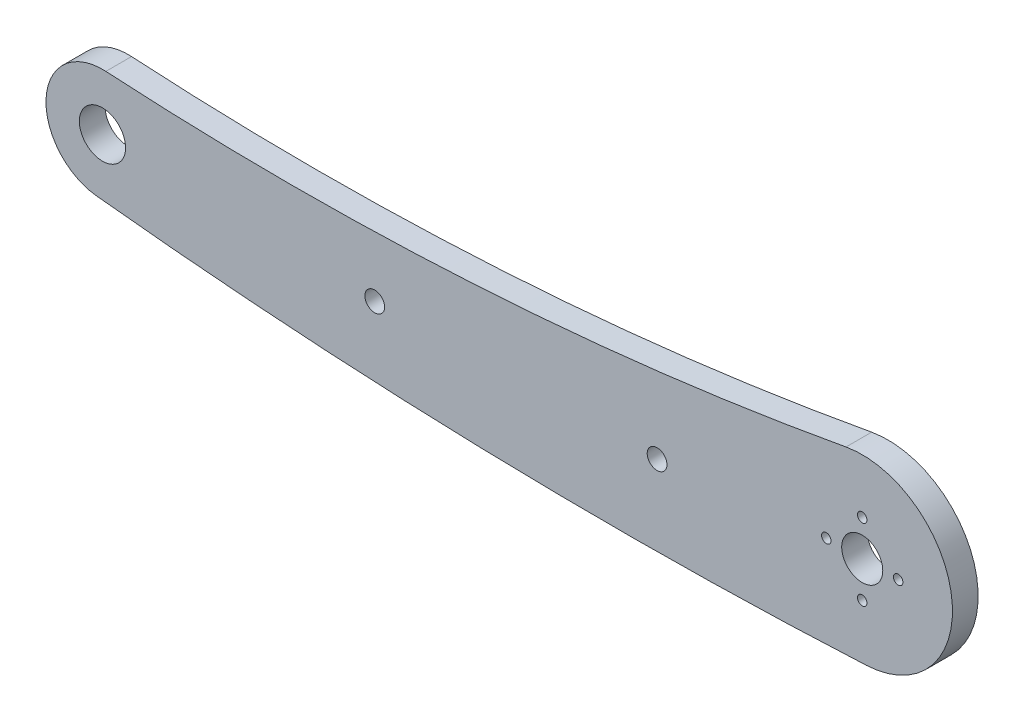
from build123d import *

# Parameters (mm, degrees)
ESQUISSE1_R        = 1.925
ESQUISSE1_R_2      = 0.925
ESQUISSE1_R_3      = 4
ESQUISSE1_R_4      = 4.5
BOSS_EXTRU_1_DEPTH = 5


with BuildPart() as part:
    # Esquisse1 → Boss.-Extru.1 (new body)
    with BuildSketch(Plane.XY):
        with BuildLine():
            ThreePointArc((-76.596505759, 7.891023923), (-88.219919815, -2.170080062), (-78.433932641, -14.026049982))
            ThreePointArc((-78.433932641, -14.026049982), (-4.607074536, -19.062713423), (69.387841086, -18.337855841))
            ThreePointArc((69.387841086, -18.337855841), (70.503800614, -18.28274944), (71.619694559, -18.226330568))
            ThreePointArc((71.619694559, -18.226330568), (88.178632292, 1.361410834), (67.556915532, 16.613388736))
            ThreePointArc((67.556915532, 16.613388736), (-4.256409128, 7.899259424), (-76.596505759, 7.891023923))
        make_face()
        with Locations((30.768040312, -3.82658336)):
            Circle(ESQUISSE1_R, mode=Mode.SUBTRACT)
        with Locations((-24.224638361, -4.723964207)):
            Circle(ESQUISSE1_R, mode=Mode.SUBTRACT)
        with Locations((77.721925672, -0.674275531)):
            Circle(ESQUISSE1_R_2, mode=Mode.SUBTRACT)
        with Locations((70.721925672, -7.674275531)):
            Circle(ESQUISSE1_R_2, mode=Mode.SUBTRACT)
        with Locations((63.721925672, -0.674275531)):
            Circle(ESQUISSE1_R_2, mode=Mode.SUBTRACT)
        with Locations((70.721925672, 6.325724469)):
            Circle(ESQUISSE1_R_2, mode=Mode.SUBTRACT)
        with Locations((70.721925672, -0.674275531)):
            Circle(ESQUISSE1_R_3, mode=Mode.SUBTRACT)
        with Locations((-77.258373302, -3.089045811)):
            Circle(ESQUISSE1_R_4, mode=Mode.SUBTRACT)
    extrude(amount=BOSS_EXTRU_1_DEPTH)


solid = part.part
